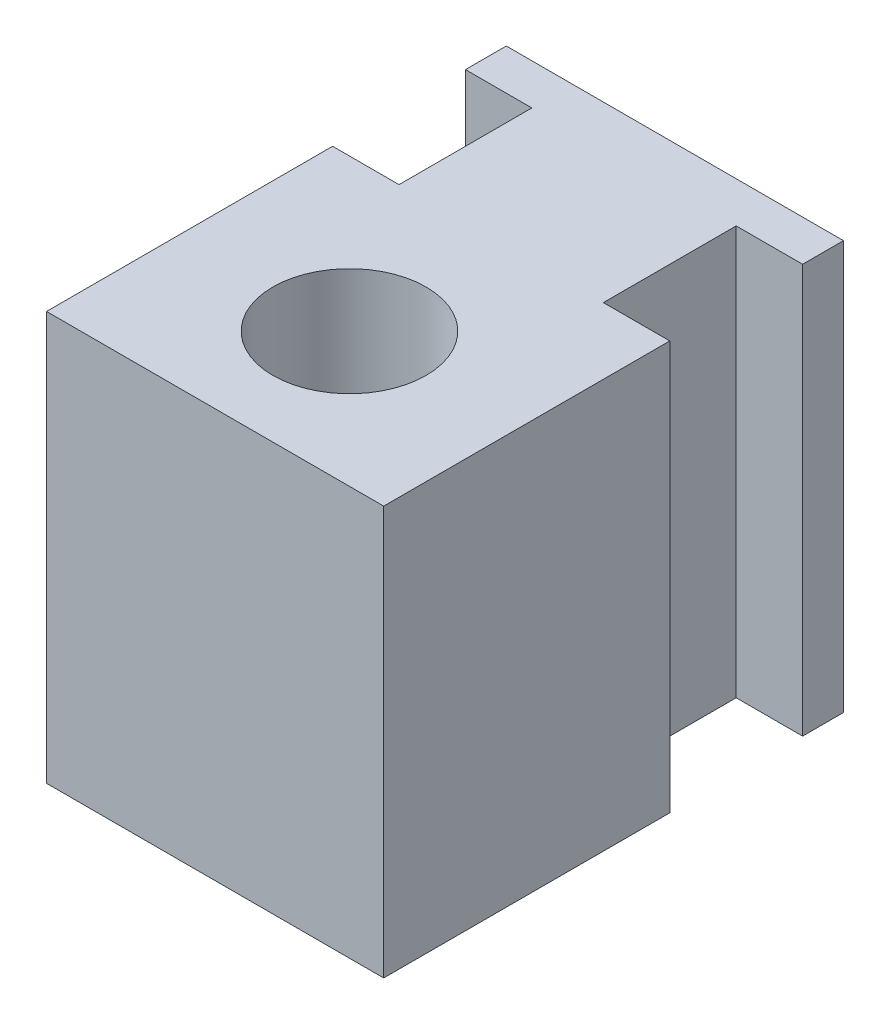
from build123d import *

# Parameters (mm, degrees)
ESBO_O1_W                      = 33
ESBO_O1_H                      = 45
RESSALTO_EXTRUS_O1_DEPTH       = 20
FURO_DE_DI_METRO_15_0_15_1_D   = 15
FURO_ROSCADO_DE_M10X1_51_D     = 8.5
FURO_ROSCADO_DE_M10X1_51_DEPTH = 17.446342369
FURO_ROSCADO_DE_M10X1_51_TIP   = 2.553657631
ESBO_O6_W                      = 6.5
ESBO_O6_H                      = 13
CORTE_EXTRUS_O1_DEPTH          = 63.42795848


with BuildPart() as part:
    # Esboço1 → Ressalto-extrusão1 (new, symmetric)
    with BuildSketch(Plane(origin=(0, 0, 0), x_dir=(1, 0, 0), z_dir=(0, 1, 0))):
        with Locations((0, 22.5)):
            Rectangle(ESBO_O1_W, ESBO_O1_H)
    extrude(amount=RESSALTO_EXTRUS_O1_DEPTH, both=True)

    # Furo de diâmetro Ø15.0 (15)1 (through all)
    with Locations(Plane(origin=(0, 20, 0), x_dir=(1, 0, 0), z_dir=(0, 1, 0))):
        with Locations((0, 13.15)):
            Hole(FURO_DE_DI_METRO_15_0_15_1_D / 2)

    # Furo roscado de M10x1.51
    with Locations(Plane(origin=(0, 0, -45), x_dir=(-1, 0, 0), z_dir=(0, 0, -1))):
        with Locations((0, 0)):
            Hole(FURO_ROSCADO_DE_M10X1_51_D / 2, depth=FURO_ROSCADO_DE_M10X1_51_DEPTH)
            with Locations((0, 0, -(FURO_ROSCADO_DE_M10X1_51_DEPTH + FURO_ROSCADO_DE_M10X1_51_TIP / 2))):  # 118° drill point
                Cone(0, FURO_ROSCADO_DE_M10X1_51_D / 2, FURO_ROSCADO_DE_M10X1_51_TIP, mode=Mode.SUBTRACT)

    # Esboço6 → Corte-extrusão1 (cut, through all)
    with BuildSketch(Plane(origin=(0, 20, 0), x_dir=(1, 0, 0), z_dir=(0, 1, 0))):
        with Locations((-13.25, 34.5)):
            Rectangle(ESBO_O6_W, ESBO_O6_H)
        with Locations((13.25, 34.5)):
            Rectangle(ESBO_O6_W, ESBO_O6_H)
    extrude(amount=-CORTE_EXTRUS_O1_DEPTH, mode=Mode.SUBTRACT)


solid = part.part
